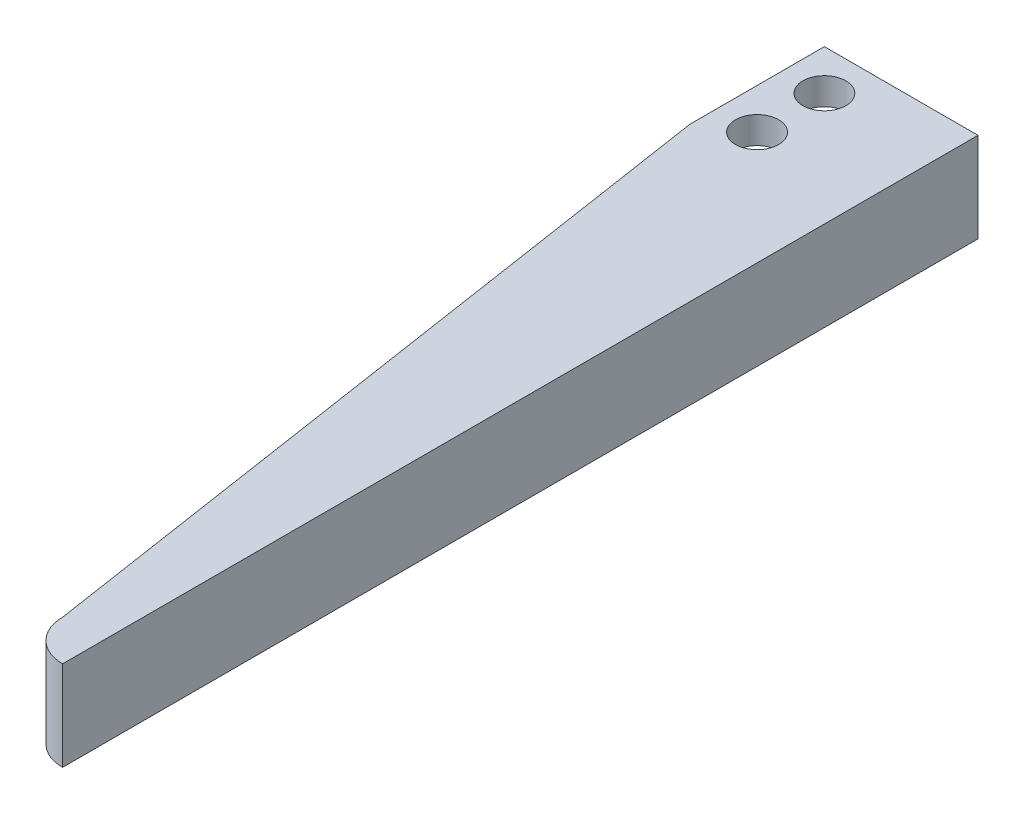
from build123d import *

# Parameters (mm, degrees)
SKETCH1_R           = 1.6
BOSS_EXTRUDE1_DEPTH = 2
BOSS_EXTRUDE2_START = 4.6625
BOSS_EXTRUDE2_DEPTH = 4.6625


with BuildPart() as part:
    # Sketch1 → Boss-Extrude1 (new body)
    with BuildSketch(Plane(origin=(0, 0, 0), x_dir=(1, 0, 0), z_dir=(0, 1, 0))):
        with BuildLine():
            Line((-5.70625, 0), (5.70625, 0))
            Line((5.70625, 0), (5.70625, -68))
            ThreePointArc((5.70625, -68), (3.584929656, -67.121320344), (2.70625, -65))
            Line((2.70625, -65), (-5.70625, -10))
            Line((-5.70625, -10), (-5.70625, 0))
        make_face()
        with Locations(Location((-2.70625, -3, 0), (0, 0, 270))):
            Circle(SKETCH1_R, mode=Mode.SUBTRACT)
        with Locations(Location((-2.70625, -8, 0), (0, 0, 270))):
            Circle(SKETCH1_R, mode=Mode.SUBTRACT)
    extrude(amount=BOSS_EXTRUDE1_DEPTH)

    # Sketch2 → Boss-Extrude2 (add)
    with BuildSketch(Plane.XZ.offset(BOSS_EXTRUDE2_START)):
        with BuildLine():
            Line((5.70625, 68), (5.70625, 0))
            Line((5.70625, 0), (2.70625, 0))
            Line((2.70625, 0), (2.70625, 65))
            ThreePointArc((2.70625, 65), (3.584929656, 67.121320344), (5.70625, 68))
        make_face()
    extrude(amount=-BOSS_EXTRUDE2_DEPTH)


solid = part.part
